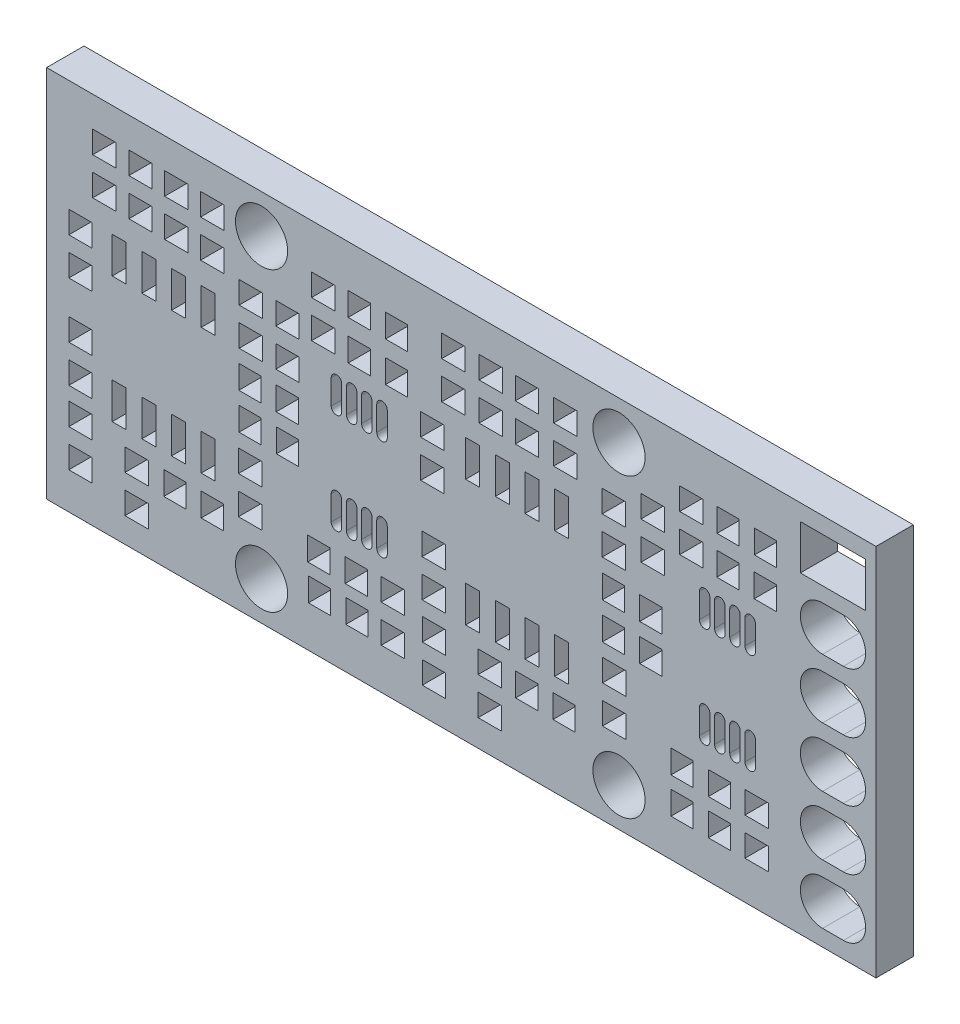
from build123d import *

# Parameters (mm, degrees)
MODEL_R            = 1.1176
MODEL_W            = 2.794
MODEL_H            = 1.905
MODEL_W_2          = 0.6
MODEL_H_2          = 1.55
MODEL_W_3          = 0.95
MODEL_H_3          = 1
MODEL_W_4          = 1
MODEL_H_4          = 0.95
BOSS_EXTRU_1_DEPTH = 1.6


with BuildPart() as part:
    # Model → Boss.-Extru.1 (new body)
    with BuildSketch(Plane.XY):
        Polygon((0, -11.02), (0, 0), (-25, 0), (-35.5, 0), (-35.5, -16), (-25, -16), (0, -16), align=None)
        with Locations((-26.3, -14.35)):
            Circle(MODEL_R, mode=Mode.SUBTRACT)
        with Locations((-11, -14.35)):
            Circle(MODEL_R, mode=Mode.SUBTRACT)
        with Locations((-26.3, -1.65)):
            Circle(MODEL_R, mode=Mode.SUBTRACT)
        with Locations((-11, -1.65)):
            Circle(MODEL_R, mode=Mode.SUBTRACT)
        with Locations((-1.84, -1.65)):
            Rectangle(MODEL_W, MODEL_H, mode=Mode.SUBTRACT)
        with BuildLine():
            Line((-1.3955, -5.1425), (-2.2845, -5.1425))
            ThreePointArc((-2.2845, -5.1425), (-3.237, -4.19), (-2.2845, -3.2375))
            Line((-2.2845, -3.2375), (-1.3955, -3.2375))
            ThreePointArc((-1.3955, -3.2375), (-0.443, -4.19), (-1.3955, -5.1425))
        make_face(mode=Mode.SUBTRACT)
        with BuildLine():
            Line((-1.3955, -7.6825), (-2.2845, -7.6825))
            ThreePointArc((-2.2845, -7.6825), (-3.237, -6.73), (-2.2845, -5.7775))
            Line((-2.2845, -5.7775), (-1.3955, -5.7775))
            ThreePointArc((-1.3955, -5.7775), (-0.443, -6.73), (-1.3955, -7.6825))
        make_face(mode=Mode.SUBTRACT)
        with BuildLine():
            Line((-1.3955, -10.2225), (-2.2845, -10.2225))
            ThreePointArc((-2.2845, -10.2225), (-3.237, -9.27), (-2.2845, -8.3175))
            Line((-2.2845, -8.3175), (-1.3955, -8.3175))
            ThreePointArc((-1.3955, -8.3175), (-0.443, -9.27), (-1.3955, -10.2225))
        make_face(mode=Mode.SUBTRACT)
        with BuildLine():
            Line((-1.3955, -12.7625), (-2.2845, -12.7625))
            ThreePointArc((-2.2845, -12.7625), (-3.237, -11.81), (-2.2845, -10.8575))
            Line((-2.2845, -10.8575), (-1.3955, -10.8575))
            ThreePointArc((-1.3955, -10.8575), (-0.443, -11.81), (-1.3955, -12.7625))
        make_face(mode=Mode.SUBTRACT)
        with BuildLine():
            Line((-1.3955, -15.3025), (-2.2845, -15.3025))
            ThreePointArc((-2.2845, -15.3025), (-3.237, -14.35), (-2.2845, -13.3975))
            Line((-2.2845, -13.3975), (-1.3955, -13.3975))
            ThreePointArc((-1.3955, -13.3975), (-0.443, -14.35), (-1.3955, -15.3025))
        make_face(mode=Mode.SUBTRACT)
        with BuildLine():
            Line((-22.87, -9.705), (-22.87, -10.755))
            ThreePointArc((-22.87, -10.755), (-23.095, -10.98), (-23.32, -10.755))
            Line((-23.32, -10.755), (-23.32, -9.705))
            ThreePointArc((-23.32, -9.705), (-23.095, -9.48), (-22.87, -9.705))
        make_face(mode=Mode.SUBTRACT)
        with BuildLine():
            Line((-22.22, -9.705), (-22.22, -10.755))
            ThreePointArc((-22.22, -10.755), (-22.445, -10.98), (-22.67, -10.755))
            Line((-22.67, -10.755), (-22.67, -9.705))
            ThreePointArc((-22.67, -9.705), (-22.445, -9.48), (-22.22, -9.705))
        make_face(mode=Mode.SUBTRACT)
        with BuildLine():
            Line((-21.57, -9.705), (-21.57, -10.755))
            ThreePointArc((-21.57, -10.755), (-21.795, -10.98), (-22.02, -10.755))
            Line((-22.02, -10.755), (-22.02, -9.705))
            ThreePointArc((-22.02, -9.705), (-21.795, -9.48), (-21.57, -9.705))
        make_face(mode=Mode.SUBTRACT)
        with BuildLine():
            Line((-20.92, -9.705), (-20.92, -10.755))
            ThreePointArc((-20.92, -10.755), (-21.145, -10.98), (-21.37, -10.755))
            Line((-21.37, -10.755), (-21.37, -9.705))
            ThreePointArc((-21.37, -9.705), (-21.145, -9.48), (-20.92, -9.705))
        make_face(mode=Mode.SUBTRACT)
        with BuildLine():
            Line((-20.92, -5.405), (-20.92, -6.455))
            ThreePointArc((-20.92, -6.455), (-21.145, -6.68), (-21.37, -6.455))
            Line((-21.37, -6.455), (-21.37, -5.405))
            ThreePointArc((-21.37, -5.405), (-21.145, -5.18), (-20.92, -5.405))
        make_face(mode=Mode.SUBTRACT)
        with BuildLine():
            Line((-21.57, -5.405), (-21.57, -6.455))
            ThreePointArc((-21.57, -6.455), (-21.795, -6.68), (-22.02, -6.455))
            Line((-22.02, -6.455), (-22.02, -5.405))
            ThreePointArc((-22.02, -5.405), (-21.795, -5.18), (-21.57, -5.405))
        make_face(mode=Mode.SUBTRACT)
        with BuildLine():
            Line((-22.22, -5.405), (-22.22, -6.455))
            ThreePointArc((-22.22, -6.455), (-22.445, -6.68), (-22.67, -6.455))
            Line((-22.67, -6.455), (-22.67, -5.405))
            ThreePointArc((-22.67, -5.405), (-22.445, -5.18), (-22.22, -5.405))
        make_face(mode=Mode.SUBTRACT)
        with BuildLine():
            Line((-22.87, -5.405), (-22.87, -6.455))
            ThreePointArc((-22.87, -6.455), (-23.095, -6.68), (-23.32, -6.455))
            Line((-23.32, -6.455), (-23.32, -5.405))
            ThreePointArc((-23.32, -5.405), (-23.095, -5.18), (-22.87, -5.405))
        make_face(mode=Mode.SUBTRACT)
        with BuildLine():
            Line((-7.11, -9.745), (-7.11, -10.795))
            ThreePointArc((-7.11, -10.795), (-7.335, -11.02), (-7.56, -10.795))
            Line((-7.56, -10.795), (-7.56, -9.745))
            ThreePointArc((-7.56, -9.745), (-7.335, -9.52), (-7.11, -9.745))
        make_face(mode=Mode.SUBTRACT)
        with BuildLine():
            Line((-6.46, -9.745), (-6.46, -10.795))
            ThreePointArc((-6.46, -10.795), (-6.685, -11.02), (-6.91, -10.795))
            Line((-6.91, -10.795), (-6.91, -9.745))
            ThreePointArc((-6.91, -9.745), (-6.685, -9.52), (-6.46, -9.745))
        make_face(mode=Mode.SUBTRACT)
        with BuildLine():
            Line((-5.81, -9.745), (-5.81, -10.795))
            ThreePointArc((-5.81, -10.795), (-6.035, -11.02), (-6.26, -10.795))
            Line((-6.26, -10.795), (-6.26, -9.745))
            ThreePointArc((-6.26, -9.745), (-6.035, -9.52), (-5.81, -9.745))
        make_face(mode=Mode.SUBTRACT)
        with BuildLine():
            Line((-5.16, -9.745), (-5.16, -10.795))
            ThreePointArc((-5.16, -10.795), (-5.385, -11.02), (-5.61, -10.795))
            Line((-5.61, -10.795), (-5.61, -9.745))
            ThreePointArc((-5.61, -9.745), (-5.385, -9.52), (-5.16, -9.745))
        make_face(mode=Mode.SUBTRACT)
        with BuildLine():
            Line((-5.16, -5.445), (-5.16, -6.495))
            ThreePointArc((-5.16, -6.495), (-5.385, -6.72), (-5.61, -6.495))
            Line((-5.61, -6.495), (-5.61, -5.445))
            ThreePointArc((-5.61, -5.445), (-5.385, -5.22), (-5.16, -5.445))
        make_face(mode=Mode.SUBTRACT)
        with BuildLine():
            Line((-5.81, -5.445), (-5.81, -6.495))
            ThreePointArc((-5.81, -6.495), (-6.035, -6.72), (-6.26, -6.495))
            Line((-6.26, -6.495), (-6.26, -5.445))
            ThreePointArc((-6.26, -5.445), (-6.035, -5.22), (-5.81, -5.445))
        make_face(mode=Mode.SUBTRACT)
        with BuildLine():
            Line((-6.46, -5.445), (-6.46, -6.495))
            ThreePointArc((-6.46, -6.495), (-6.685, -6.72), (-6.91, -6.495))
            Line((-6.91, -6.495), (-6.91, -5.445))
            ThreePointArc((-6.91, -5.445), (-6.685, -5.22), (-6.46, -5.445))
        make_face(mode=Mode.SUBTRACT)
        with BuildLine():
            Line((-7.11, -5.445), (-7.11, -6.495))
            ThreePointArc((-7.11, -6.495), (-7.335, -6.72), (-7.56, -6.495))
            Line((-7.56, -6.495), (-7.56, -5.445))
            ThreePointArc((-7.56, -5.445), (-7.335, -5.22), (-7.11, -5.445))
        make_face(mode=Mode.SUBTRACT)
        with Locations((-28.585, -5.55)):
            Rectangle(MODEL_W_2, MODEL_H_2, mode=Mode.SUBTRACT)
        with Locations((-29.855, -5.55)):
            Rectangle(MODEL_W_2, MODEL_H_2, mode=Mode.SUBTRACT)
        with Locations((-31.125, -5.55)):
            Rectangle(MODEL_W_2, MODEL_H_2, mode=Mode.SUBTRACT)
        with Locations((-32.395, -5.55)):
            Rectangle(MODEL_W_2, MODEL_H_2, mode=Mode.SUBTRACT)
        with Locations((-32.395, -10.95)):
            Rectangle(MODEL_W_2, MODEL_H_2, mode=Mode.SUBTRACT)
        with Locations((-31.125, -10.95)):
            Rectangle(MODEL_W_2, MODEL_H_2, mode=Mode.SUBTRACT)
        with Locations((-29.855, -10.95)):
            Rectangle(MODEL_W_2, MODEL_H_2, mode=Mode.SUBTRACT)
        with Locations((-28.585, -10.95)):
            Rectangle(MODEL_W_2, MODEL_H_2, mode=Mode.SUBTRACT)
        with Locations((-13.455, -5.52)):
            Rectangle(MODEL_W_2, MODEL_H_2, mode=Mode.SUBTRACT)
        with Locations((-14.725, -5.52)):
            Rectangle(MODEL_W_2, MODEL_H_2, mode=Mode.SUBTRACT)
        with Locations((-15.995, -5.52)):
            Rectangle(MODEL_W_2, MODEL_H_2, mode=Mode.SUBTRACT)
        with Locations((-17.265, -5.52)):
            Rectangle(MODEL_W_2, MODEL_H_2, mode=Mode.SUBTRACT)
        with Locations((-17.265, -10.92)):
            Rectangle(MODEL_W_2, MODEL_H_2, mode=Mode.SUBTRACT)
        with Locations((-15.995, -10.92)):
            Rectangle(MODEL_W_2, MODEL_H_2, mode=Mode.SUBTRACT)
        with Locations((-14.725, -10.92)):
            Rectangle(MODEL_W_2, MODEL_H_2, mode=Mode.SUBTRACT)
        with Locations((-13.455, -10.92)):
            Rectangle(MODEL_W_2, MODEL_H_2, mode=Mode.SUBTRACT)
        with Locations((-23.85, -12.24)):
            Rectangle(MODEL_W_3, MODEL_H_3, mode=Mode.SUBTRACT)
        with Locations((-22.25, -12.24)):
            Rectangle(MODEL_W_3, MODEL_H_3, mode=Mode.SUBTRACT)
        with Locations((-33.03, -1.77)):
            Rectangle(MODEL_W_4, MODEL_H_4, mode=Mode.SUBTRACT)
        with Locations((-33.03, -3.37)):
            Rectangle(MODEL_W_4, MODEL_H_4, mode=Mode.SUBTRACT)
        with Locations((-34.05, -9.23)):
            Rectangle(MODEL_W_4, MODEL_H_4, mode=Mode.SUBTRACT)
        with Locations((-34.05, -10.83)):
            Rectangle(MODEL_W_4, MODEL_H_4, mode=Mode.SUBTRACT)
        with Locations((-34.05, -12.36)):
            Rectangle(MODEL_W_4, MODEL_H_4, mode=Mode.SUBTRACT)
        with Locations((-34.05, -13.96)):
            Rectangle(MODEL_W_4, MODEL_H_4, mode=Mode.SUBTRACT)
        with Locations((-26.79, -8.9)):
            Rectangle(MODEL_W_3, MODEL_H_3, mode=Mode.SUBTRACT)
        with Locations((-25.19, -8.9)):
            Rectangle(MODEL_W_3, MODEL_H_3, mode=Mode.SUBTRACT)
        with Locations((-31.65, -12.86)):
            Rectangle(MODEL_W_4, MODEL_H_4, mode=Mode.SUBTRACT)
        with Locations((-31.65, -14.46)):
            Rectangle(MODEL_W_4, MODEL_H_4, mode=Mode.SUBTRACT)
        with Locations((-26.8, -7.35)):
            Rectangle(MODEL_W_3, MODEL_H_3, mode=Mode.SUBTRACT)
        with Locations((-25.2, -7.35)):
            Rectangle(MODEL_W_3, MODEL_H_3, mode=Mode.SUBTRACT)
        with Locations((-34.05, -5.25)):
            Rectangle(MODEL_W_4, MODEL_H_4, mode=Mode.SUBTRACT)
        with Locations((-34.05, -6.85)):
            Rectangle(MODEL_W_4, MODEL_H_4, mode=Mode.SUBTRACT)
        with Locations((-28.41, -12.89)):
            Rectangle(MODEL_W_3, MODEL_H_3, mode=Mode.SUBTRACT)
        with Locations((-30.01, -12.89)):
            Rectangle(MODEL_W_3, MODEL_H_3, mode=Mode.SUBTRACT)
        with Locations((-22.12, -4)):
            Rectangle(MODEL_W_3, MODEL_H_3, mode=Mode.SUBTRACT)
        with Locations((-20.52, -4)):
            Rectangle(MODEL_W_3, MODEL_H_3, mode=Mode.SUBTRACT)
        with Locations((-29.95, -1.77)):
            Rectangle(MODEL_W_4, MODEL_H_4, mode=Mode.SUBTRACT)
        with Locations((-29.95, -3.37)):
            Rectangle(MODEL_W_4, MODEL_H_4, mode=Mode.SUBTRACT)
        with Locations((-25.19, -5.8)):
            Rectangle(MODEL_W_4, MODEL_H_4, mode=Mode.SUBTRACT)
        with Locations((-25.19, -4.2)):
            Rectangle(MODEL_W_4, MODEL_H_4, mode=Mode.SUBTRACT)
        with Locations((-28.41, -3.37)):
            Rectangle(MODEL_W_4, MODEL_H_4, mode=Mode.SUBTRACT)
        with Locations((-28.41, -1.77)):
            Rectangle(MODEL_W_4, MODEL_H_4, mode=Mode.SUBTRACT)
        with Locations((-8.3, -12.36)):
            Rectangle(MODEL_W_3, MODEL_H_3, mode=Mode.SUBTRACT)
        with Locations((-6.7, -12.36)):
            Rectangle(MODEL_W_3, MODEL_H_3, mode=Mode.SUBTRACT)
        with Locations((-18.09, -1.86)):
            Rectangle(MODEL_W_4, MODEL_H_4, mode=Mode.SUBTRACT)
        with Locations((-18.09, -3.46)):
            Rectangle(MODEL_W_4, MODEL_H_4, mode=Mode.SUBTRACT)
        with Locations((-18.93, -9.62)):
            Rectangle(MODEL_W_4, MODEL_H_4, mode=Mode.SUBTRACT)
        with Locations((-18.93, -11.22)):
            Rectangle(MODEL_W_4, MODEL_H_4, mode=Mode.SUBTRACT)
        with Locations((-18.92, -12.78)):
            Rectangle(MODEL_W_4, MODEL_H_4, mode=Mode.SUBTRACT)
        with Locations((-18.92, -14.38)):
            Rectangle(MODEL_W_4, MODEL_H_4, mode=Mode.SUBTRACT)
        with Locations((-11.24, -8.9)):
            Rectangle(MODEL_W_3, MODEL_H_3, mode=Mode.SUBTRACT)
        with Locations((-9.64, -8.9)):
            Rectangle(MODEL_W_3, MODEL_H_3, mode=Mode.SUBTRACT)
        with Locations((-16.53, -12.79)):
            Rectangle(MODEL_W_4, MODEL_H_4, mode=Mode.SUBTRACT)
        with Locations((-16.53, -14.39)):
            Rectangle(MODEL_W_4, MODEL_H_4, mode=Mode.SUBTRACT)
        with Locations((-11.24, -7.34)):
            Rectangle(MODEL_W_3, MODEL_H_3, mode=Mode.SUBTRACT)
        with Locations((-9.64, -7.34)):
            Rectangle(MODEL_W_3, MODEL_H_3, mode=Mode.SUBTRACT)
        with Locations((-18.99, -5.22)):
            Rectangle(MODEL_W_4, MODEL_H_4, mode=Mode.SUBTRACT)
        with Locations((-18.99, -6.82)):
            Rectangle(MODEL_W_4, MODEL_H_4, mode=Mode.SUBTRACT)
        with Locations((-13.35, -12.83)):
            Rectangle(MODEL_W_3, MODEL_H_3, mode=Mode.SUBTRACT)
        with Locations((-14.95, -12.83)):
            Rectangle(MODEL_W_3, MODEL_H_3, mode=Mode.SUBTRACT)
        with Locations((-6.34, -4.05)):
            Rectangle(MODEL_W_3, MODEL_H_3, mode=Mode.SUBTRACT)
        with Locations((-4.74, -4.05)):
            Rectangle(MODEL_W_3, MODEL_H_3, mode=Mode.SUBTRACT)
        with Locations((-14.94, -1.85)):
            Rectangle(MODEL_W_4, MODEL_H_4, mode=Mode.SUBTRACT)
        with Locations((-14.94, -3.45)):
            Rectangle(MODEL_W_4, MODEL_H_4, mode=Mode.SUBTRACT)
        with Locations((-9.56, -5.14)):
            Rectangle(MODEL_W_4, MODEL_H_4, mode=Mode.SUBTRACT)
        with Locations((-9.56, -3.54)):
            Rectangle(MODEL_W_4, MODEL_H_4, mode=Mode.SUBTRACT)
        with Locations((-13.3, -3.45)):
            Rectangle(MODEL_W_4, MODEL_H_4, mode=Mode.SUBTRACT)
        with Locations((-13.3, -1.85)):
            Rectangle(MODEL_W_4, MODEL_H_4, mode=Mode.SUBTRACT)
        with Locations((-22.22, -13.74)):
            Rectangle(MODEL_W_3, MODEL_H_3, mode=Mode.SUBTRACT)
        with Locations((-23.82, -13.74)):
            Rectangle(MODEL_W_3, MODEL_H_3, mode=Mode.SUBTRACT)
        with Locations((-26.79, -10.47)):
            Rectangle(MODEL_W_4, MODEL_H_4, mode=Mode.SUBTRACT)
        with Locations((-26.79, -12.07)):
            Rectangle(MODEL_W_4, MODEL_H_4, mode=Mode.SUBTRACT)
        with Locations((-26.76, -5.81)):
            Rectangle(MODEL_W_4, MODEL_H_4, mode=Mode.SUBTRACT)
        with Locations((-26.76, -4.21)):
            Rectangle(MODEL_W_4, MODEL_H_4, mode=Mode.SUBTRACT)
        with Locations((-23.66, -2.38)):
            Rectangle(MODEL_W_4, MODEL_H_4, mode=Mode.SUBTRACT)
        with Locations((-23.66, -3.98)):
            Rectangle(MODEL_W_4, MODEL_H_4, mode=Mode.SUBTRACT)
        with Locations((-22.12, -2.31)):
            Rectangle(MODEL_W_3, MODEL_H_3, mode=Mode.SUBTRACT)
        with Locations((-20.52, -2.31)):
            Rectangle(MODEL_W_3, MODEL_H_3, mode=Mode.SUBTRACT)
        with Locations((-20.68, -12.18)):
            Rectangle(MODEL_W_4, MODEL_H_4, mode=Mode.SUBTRACT)
        with Locations((-20.68, -13.78)):
            Rectangle(MODEL_W_4, MODEL_H_4, mode=Mode.SUBTRACT)
        with Locations((-31.48, -3.37)):
            Rectangle(MODEL_W_4, MODEL_H_4, mode=Mode.SUBTRACT)
        with Locations((-31.48, -1.77)):
            Rectangle(MODEL_W_4, MODEL_H_4, mode=Mode.SUBTRACT)
        with Locations((-6.7, -13.89)):
            Rectangle(MODEL_W_3, MODEL_H_3, mode=Mode.SUBTRACT)
        with Locations((-8.3, -13.89)):
            Rectangle(MODEL_W_3, MODEL_H_3, mode=Mode.SUBTRACT)
        with Locations((-11.21, -10.44)):
            Rectangle(MODEL_W_4, MODEL_H_4, mode=Mode.SUBTRACT)
        with Locations((-11.21, -12.04)):
            Rectangle(MODEL_W_4, MODEL_H_4, mode=Mode.SUBTRACT)
        with Locations((-11.22, -5.78)):
            Rectangle(MODEL_W_4, MODEL_H_4, mode=Mode.SUBTRACT)
        with Locations((-11.22, -4.18)):
            Rectangle(MODEL_W_4, MODEL_H_4, mode=Mode.SUBTRACT)
        with Locations((-7.9, -2.43)):
            Rectangle(MODEL_W_4, MODEL_H_4, mode=Mode.SUBTRACT)
        with Locations((-7.9, -4.03)):
            Rectangle(MODEL_W_4, MODEL_H_4, mode=Mode.SUBTRACT)
        with Locations((-6.33, -2.42)):
            Rectangle(MODEL_W_3, MODEL_H_3, mode=Mode.SUBTRACT)
        with Locations((-4.73, -2.42)):
            Rectangle(MODEL_W_3, MODEL_H_3, mode=Mode.SUBTRACT)
        with Locations((-5.11, -12.29)):
            Rectangle(MODEL_W_4, MODEL_H_4, mode=Mode.SUBTRACT)
        with Locations((-5.11, -13.89)):
            Rectangle(MODEL_W_4, MODEL_H_4, mode=Mode.SUBTRACT)
        with Locations((-16.49, -3.45)):
            Rectangle(MODEL_W_4, MODEL_H_4, mode=Mode.SUBTRACT)
        with Locations((-16.49, -1.85)):
            Rectangle(MODEL_W_4, MODEL_H_4, mode=Mode.SUBTRACT)
    extrude(amount=BOSS_EXTRU_1_DEPTH)


solid = part.part
